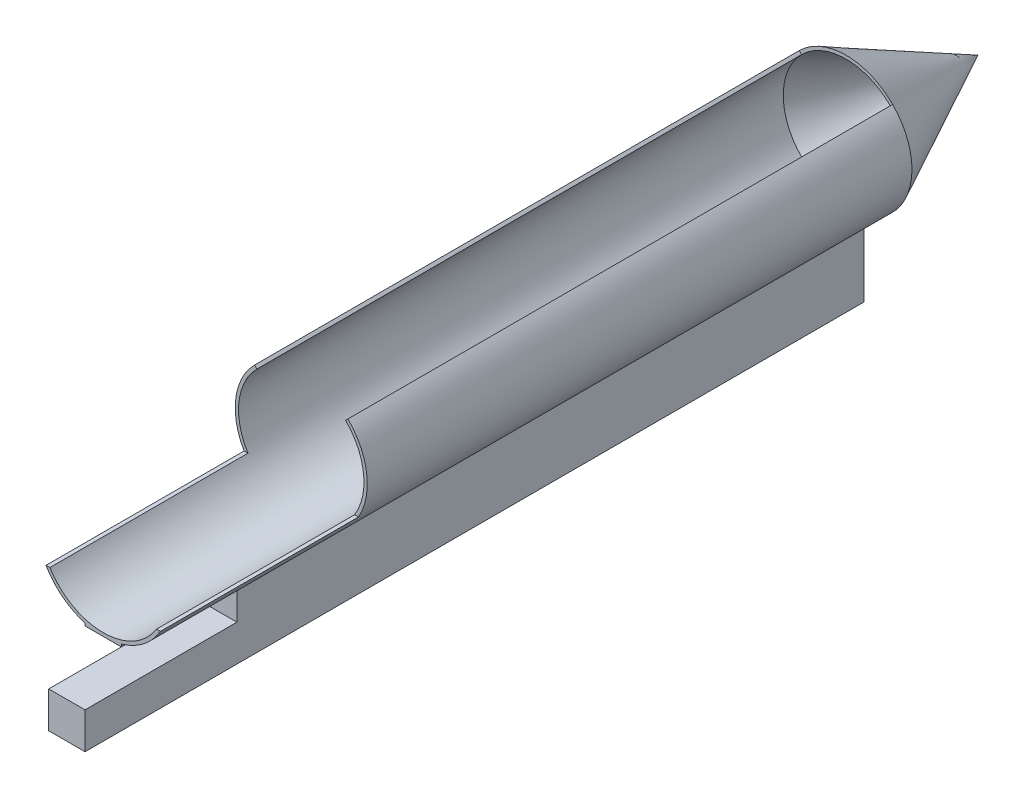
from build123d import *

# Parameters (mm, degrees)
BOSS_EXTRU_1_DEPTH      = 472
ESQUISSE2_W             = 165
ESQUISSE2_H             = 124
ENL_V_MAT_EXTRU_1_DEPTH = 22
ESQUISSE3_W             = 50
ESQUISSE3_H             = 22
ENL_V_MAT_EXTRU_2_DEPTH = 70
ENL_V_MAT_EXTRU_3_DEPTH = 120


with BuildPart() as part:
    # Esquisse1 → Boss.-Extru.1 (new body)
    with BuildSketch(Plane.XY):
        with BuildLine():
            Line((-11, -38.457769046), (-11, -84))
            Line((-11, -84), (11, -84))
            Line((11, -84), (11, -38.457769046))
            ThreePointArc((11, -38.457769046), (38.722583559, -10.028036822), (28.284271247, 28.284271247))
            Line((28.284271247, 28.284271247), (26.870057685, 26.870057685))
            ThreePointArc((26.870057685, 26.870057685), (0, -38), (-26.870057685, 26.870057685))
            Line((-26.870057685, 26.870057685), (-28.284271247, 28.284271247))
            ThreePointArc((-28.284271247, 28.284271247), (-38.722583559, -10.028036822), (-11, -38.457769046))
        make_face()
    extrude(amount=BOSS_EXTRU_1_DEPTH)

    # Esquisse2 → Enlèv. mat.-Extru.1 (cut)
    with BuildSketch(Plane.XY.offset(472)):
        Rectangle(ESQUISSE2_W, ESQUISSE2_H)
    extrude(amount=-ENL_V_MAT_EXTRU_1_DEPTH, mode=Mode.SUBTRACT)

    # Esquisse3 → Enlèv. mat.-Extru.2 (cut)
    with BuildSketch(Plane.XY.offset(450)):
        with Locations((0, -51)):
            Rectangle(ESQUISSE3_W, ESQUISSE3_H)
    extrude(amount=-ENL_V_MAT_EXTRU_2_DEPTH, mode=Mode.SUBTRACT)

    # Esquisse4 → Enlèv. mat.-Extru.3 (cut)
    with BuildSketch(Plane.XY.offset(450)):
        Polygon((-67.5, 20), (-67.5, -20), (67.5, -20), (67.5, 20), (67.5, 60), (-67.5, 60), align=None)
    extrude(amount=-ENL_V_MAT_EXTRU_3_DEPTH, mode=Mode.SUBTRACT)

    # Esquisse6 → Révolution1 (revolve)
    with BuildSketch(Plane(origin=(0, 0, 0), x_dir=(1, 0, 0), z_dir=(0, 1, 0)), mode=Mode.PRIVATE) as r_volution1_sk:
        Polygon((0, 80), (-40, 0), (-38, 0), (0, 76), align=None)
    revolve(r_volution1_sk.sketch.rotate(Axis((0, 0, 0), (0, 0, -1)), 180), axis=Axis((0, 0, 0), (0, 0, -1)))


solid = part.part
